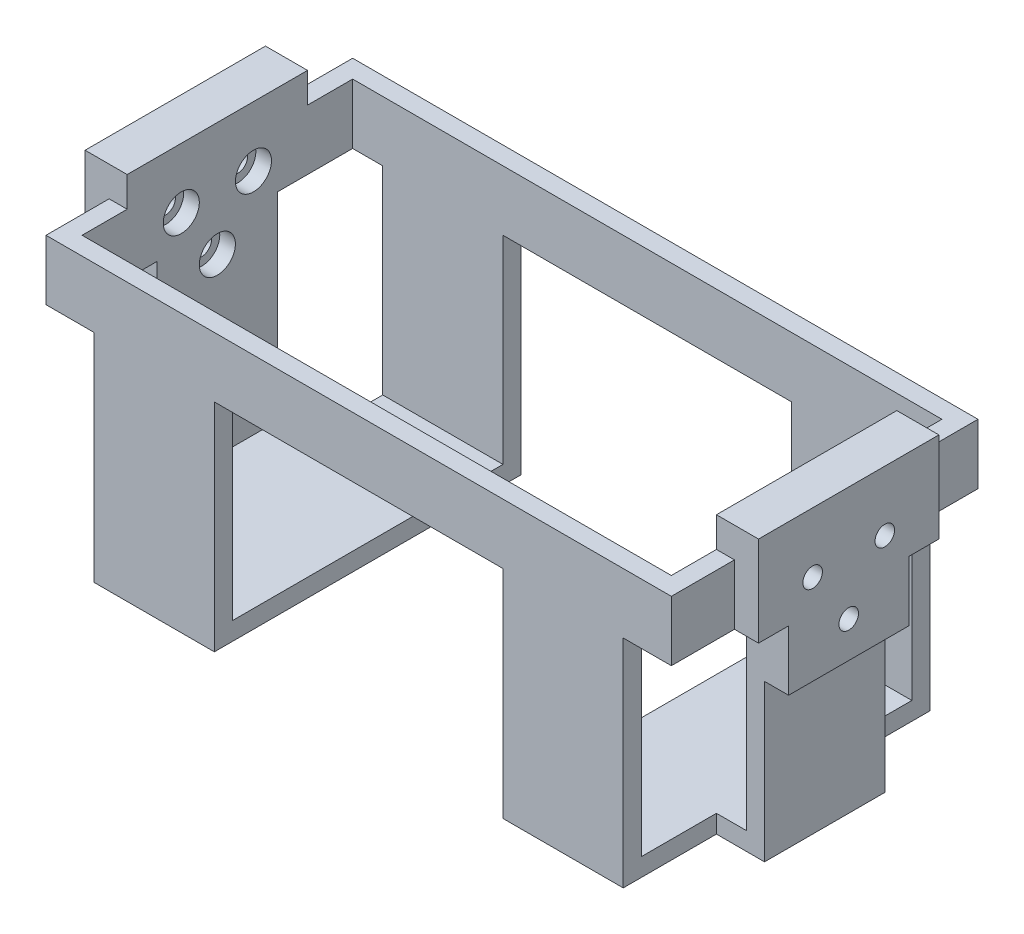
from build123d import *

# Parameters (mm, degrees)
EXTRUDE_1_DEPTH     = 3
EXTRUDE_1_2_DEPTH   = 3
SKETCH_2_W          = 20
SKETCH_2_H          = 3
SKETCH_2_W_2        = 3
SKETCH_2_H_2        = 20
EXTRUDE_2_DEPTH     = 43
SKETCH_3_W          = 48
SKETCH_3_H          = 3
EXTRUDE_3_DEPTH     = 10
EXTRUDE_4_DEPTH     = 4
SKETCH_5_R          = 3
CUT_EXTRUDE_1_DEPTH = 2.6
SKETCH_7_R          = 1.625
CUT_EXTRUDE_2_DEPTH = 117.186100718
SKETCH_8_W          = 7
SKETCH_8_H          = 30
EXTRUDE_5_DEPTH     = 5


with BuildPart() as part:
    # Эскиз1 → Бобышка-Вытянуть1 (new body)
    with BuildSketch(Plane(origin=(0, 0, 0), x_dir=(1, 0, 0), z_dir=(0, 1, 0))):
        Polygon((24, 25.5), (44, 25.5), (44, 10), (52, 10), (52, -10), (44, -10), (44, -25.5), (24, -25.5), align=None)
    extrude(amount=EXTRUDE_1_DEPTH)



with BuildPart() as body_2:
    # Эскиз1 → Extrude 1 2 (new body)
    with BuildSketch(Plane(origin=(0, 0, 0), x_dir=(1, 0, 0), z_dir=(0, 1, 0))):
        Polygon((-24, -25.5), (-24, 25.5), (-44, 25.5), (-44, 10), (-52, 10), (-52, -10), (-44, -10), (-44, -25.5), align=None)
    extrude(amount=EXTRUDE_1_2_DEPTH)


with BuildPart() as part_1:
    add(part.part)

    add(body_2.part)  # Бобышка-Вытянуть2 merges body 2
    # Эскиз2 → Бобышка-Вытянуть2 (add)
    with BuildSketch(Plane(origin=(0, 3, 0), x_dir=(1, 0, 0), z_dir=(0, 1, 0))):
        with Locations((34, 24)):
            Rectangle(SKETCH_2_W, SKETCH_2_H)
        with Locations((50.5, 0)):
            Rectangle(SKETCH_2_W_2, SKETCH_2_H_2)
        with Locations((34, -24)):
            Rectangle(SKETCH_2_W, SKETCH_2_H)
        with Locations((-34, -24)):
            Rectangle(SKETCH_2_W, SKETCH_2_H)
        with Locations((-50.5, 0)):
            Rectangle(SKETCH_2_W_2, SKETCH_2_H_2)
        with Locations((-34, 24)):
            Rectangle(SKETCH_2_W, SKETCH_2_H)
    extrude(amount=EXTRUDE_2_DEPTH)

    # Эскиз3 → Бобышка-Вытянуть3 (add)
    with BuildSketch(Plane(origin=(0, 46, 0), x_dir=(1, 0, 0), z_dir=(0, 1, 0))):
        Polygon((44, 25.5), (52, 25.5), (52, 10), (49, 10), (49, 22.5), (44, 22.5), align=None)
        with Locations((0, 24)):
            Rectangle(SKETCH_3_W, SKETCH_3_H)
        Polygon((-44, 22.5), (-44, 25.5), (-52, 25.5), (-52, 10), (-49, 10), (-49, 22.5), align=None)
        Polygon((-44, -25.5), (-52, -25.5), (-52, -10), (-49, -10), (-49, -22.5), (-44, -22.5), align=None)
        Polygon((44, -22.5), (44, -25.5), (52, -25.5), (52, -10), (49, -10), (49, -22.5), align=None)
        with Locations((0, -24)):
            Rectangle(SKETCH_3_W, SKETCH_3_H)
    extrude(amount=-EXTRUDE_3_DEPTH)

    # Эскиз4 → Бобышка-Вытянуть4 (add)
    with BuildSketch(Plane.ZY.offset(52)):
        Polygon((-10, 26), (10, 26), (10, 36), (15, 36), (15, 46), (-15, 46), (-15, 36), (-10, 36), align=None)
    extrude_4 = extrude(amount=EXTRUDE_4_DEPTH)

    # Эскиз5 → Вырез-Вытянуть1 (cut)
    with BuildSketch(Plane(origin=(-49, 0, 0), x_dir=(0, 0, -1), z_dir=(1, 0, 0))):
        with Locations((-6, 41)):
            Circle(SKETCH_5_R)
        with Locations((0, 32)):
            Circle(SKETCH_5_R)
        with Locations(Location((6, 41, 0), (0, 0, 180))):
            Circle(SKETCH_5_R)
    cut_extrude_1 = extrude(amount=-CUT_EXTRUDE_1_DEPTH, mode=Mode.SUBTRACT)

    # Эскиз7 → Вырез-Вытянуть2 (cut, through all)
    with BuildSketch(Plane(origin=(-51.6, 0, 0), x_dir=(0, 0, -1), z_dir=(1, 0, 0))):
        with Locations((-6, 41)):
            Circle(SKETCH_7_R)
        with Locations((6, 41)):
            Circle(SKETCH_7_R)
        with Locations((0, 32)):
            Circle(SKETCH_7_R)
    cut_extrude_2 = extrude(amount=-CUT_EXTRUDE_2_DEPTH, mode=Mode.SUBTRACT)

    # Зеркальное отражение2: Бобышка-Вытянуть4, Вырез-Вытянуть1, Вырез-Вытянуть2 across plane
    add(extrude_4.mirror(Plane(origin=(0, 0, 0), x_dir=(0, 0, 1), z_dir=(1, 0, 0))))
    add(cut_extrude_1.mirror(Plane(origin=(0, 0, 0), x_dir=(0, 0, 1), z_dir=(1, 0, 0))), mode=Mode.SUBTRACT)
    add(cut_extrude_2.mirror(Plane(origin=(0, 0, 0), x_dir=(0, 0, 1), z_dir=(1, 0, 0))), mode=Mode.SUBTRACT)

    # Эскиз8 → Бобышка-Вытянуть5 (add)
    with BuildSketch(Plane(origin=(0, 46, 0), x_dir=(1, 0, 0), z_dir=(0, 1, 0))):
        with Locations((-52.5, 0)):
            Rectangle(SKETCH_8_W, SKETCH_8_H)
        with Locations((52.5, 0)):
            Rectangle(SKETCH_8_W, SKETCH_8_H)
    extrude(amount=EXTRUDE_5_DEPTH)


solid = part_1.part
